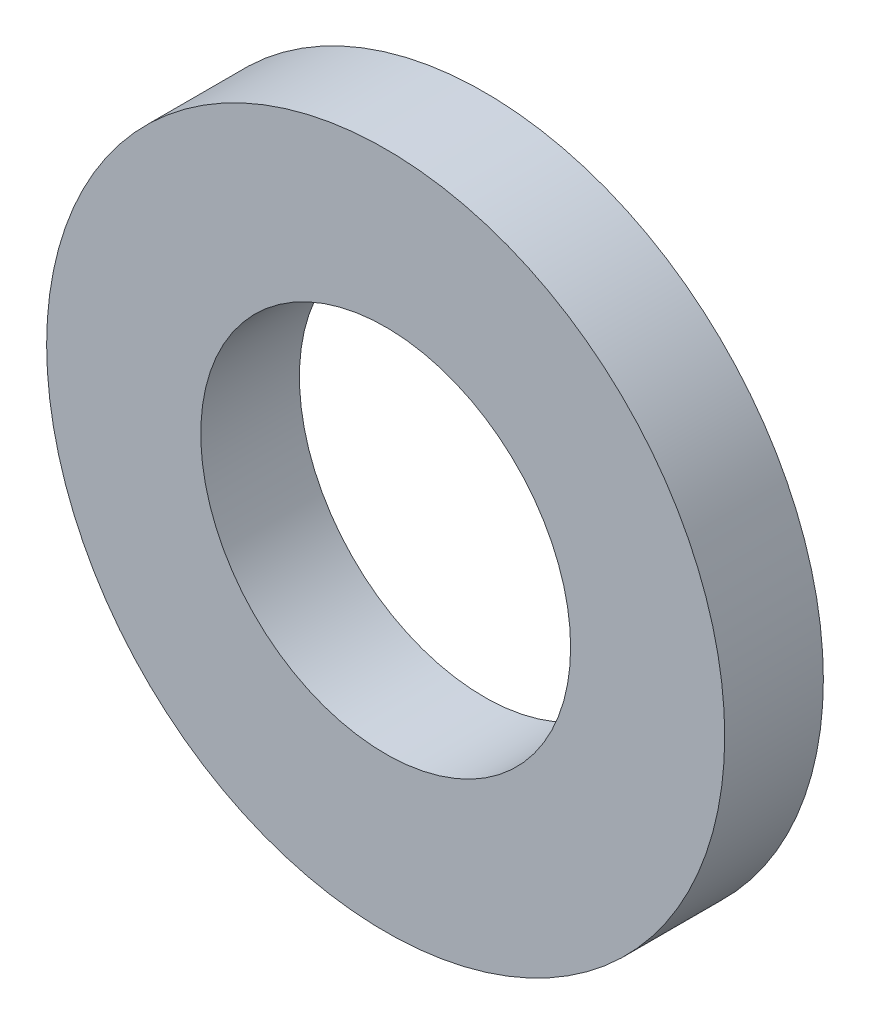
from build123d import *

# Parameters (mm, degrees)
SKETCH_1_R      = 5.5
SKETCH_1_R_2    = 3
EXTRUDE_1_DEPTH = 1.6


with BuildPart() as part:
    # 草图1 → 凸台-拉伸1 (new body)
    with BuildSketch(Plane.XY):
        Circle(SKETCH_1_R)
        Circle(SKETCH_1_R_2, mode=Mode.SUBTRACT)
    extrude(amount=EXTRUDE_1_DEPTH)


solid = part.part
